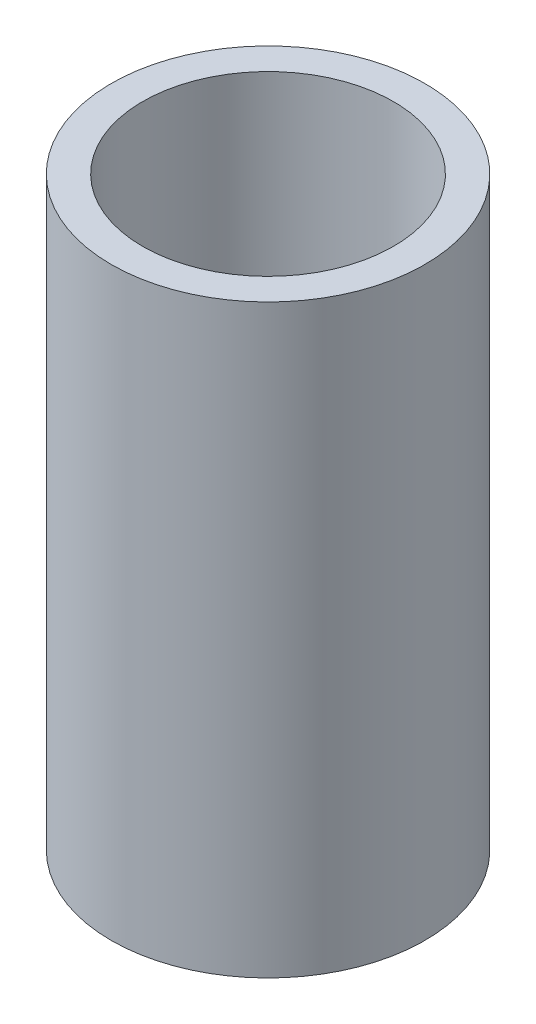
from build123d import *

# Parameters (mm, degrees)
SKETCH1_R           = 7.5
SKETCH1_R_2         = 6
BOSS_EXTRUDE1_DEPTH = 28


with BuildPart() as part:
    # Sketch1 → Boss-Extrude1 (new body)
    with BuildSketch(Plane(origin=(0, 0, 0), x_dir=(1, 0, 0), z_dir=(0, 1, 0))):
        with Locations(Location((0, 0, 0), (0, 0, 270))):
            Circle(SKETCH1_R)
        with Locations(Location((0, 0, 0), (0, 0, 270))):
            Circle(SKETCH1_R_2, mode=Mode.SUBTRACT)
    extrude(amount=BOSS_EXTRUDE1_DEPTH)


solid = part.part
